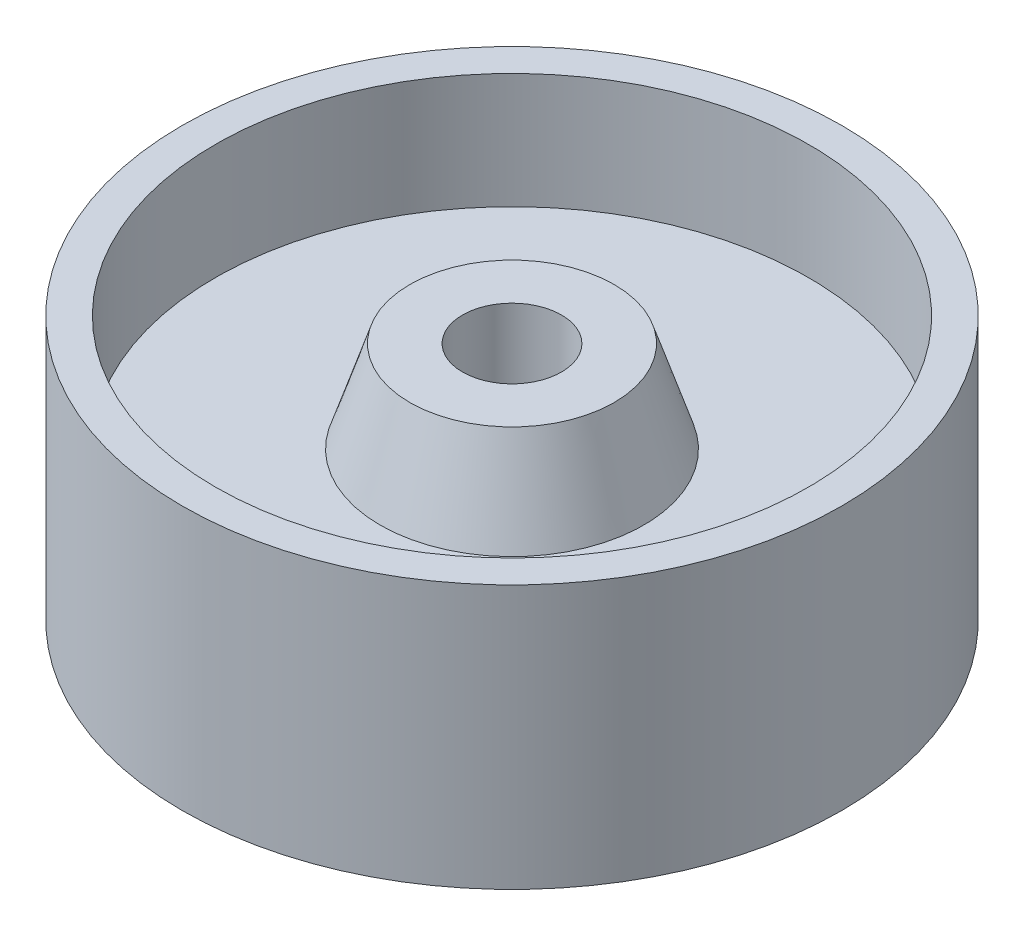
from build123d import *


with BuildPart() as part:
    # Sketch1 → Revolve1 (revolve)
    with BuildSketch(Plane(origin=(0, 0, 0), x_dir=(0, 0, -1), z_dir=(1, 0, 0))):
        Polygon((-2.5, -1), (-2.5, 1), (-2.25, 1), (-2.25, 0.125), (-1, 0.125), (-0.775, 0.817478796), (-0.375, 0.817478796), (-0.375, -0.817478796), (-0.775, -0.817478796), (-1, -0.125), (-2.25, -0.125), (-2.25, -1), align=None)
    revolve(axis=Axis((0, 2.453571429, 0), (0, -1, 0)))


solid = part.part
